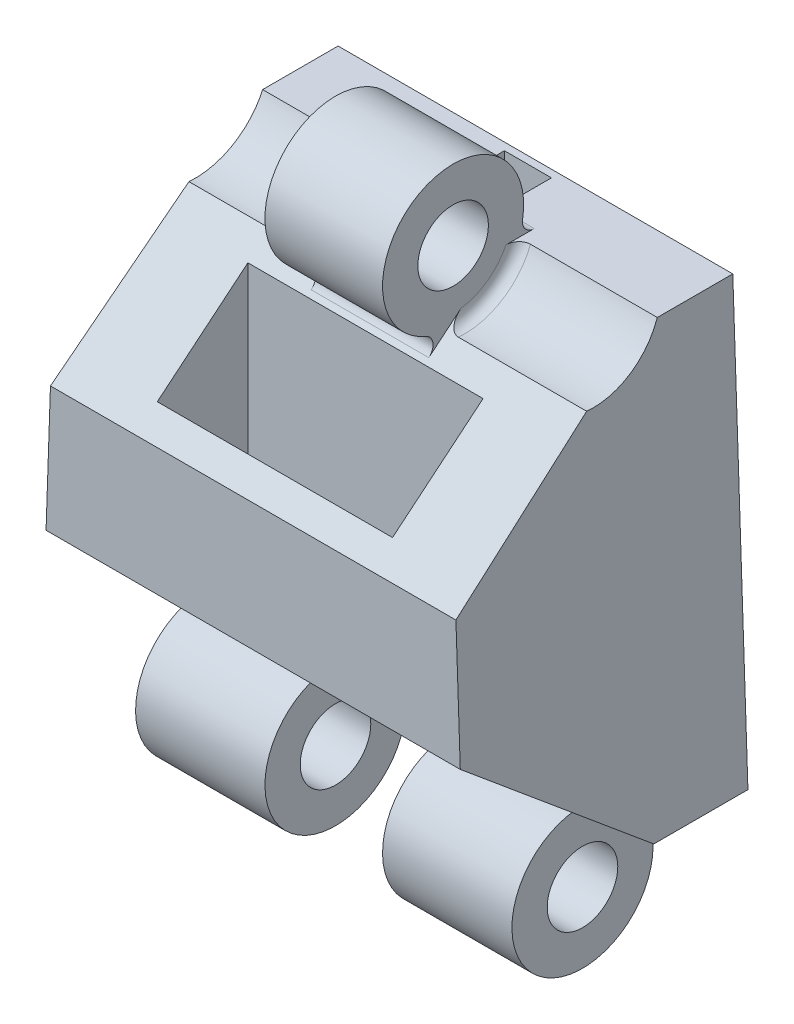
from build123d import *

# Parameters (mm, degrees)
BOSS_EXTRUDE2_DEPTH             = 12
CUT_EXTRUDE2_DEPTH              = 22.571014648492383
CUT_EXTRUDE2_DEPTH_BACK         = 22.571014648492383
SKETCH17_R                      = 3.0000000000000298
SKETCH17_R_2                    = 1.5000000000000007
BOSS_EXTRUDE3_DEPTH             = 2.5
CUT_EXTRUDE3_DEPTH              = 25.679395227729078
CUT_EXTRUDE3_DEPTH_BACK         = 25.679395227729078
SKETCH19_R                      = 1.4999999999999996
BOSS_EXTRUDE4_DEPTH             = 8
SKETCH19_3_R                    = 3.0000000000000004
CUT_EXTRUDE4_DEPTH              = 2.5
CUT_EXTRUDE5_START              = 10
SKETCH20_R                      = 2.9999999999999996
CUT_EXTRUDE5_DEPTH              = 10
SKETCH21_R                      = 2.999999999999999
CUT_EXTRUDE6_DEPTH              = 10
FILLET6_R                       = 0.5000000000000004
FILLET7_R                       = 0.5000000000000004
FILLET8_R                       = 0.5000000000000004
CUT_EXTRUDE8_DEPTH              = 25.679395276352636
CUT_EXTRUDE8_DEPTH_BACK         = 25.679395276352636
CUT_EXTRUDE9_DEPTH              = 24.90754642395463
CUT_EXTRUDE9_DEPTH_BACK         = 24.90754642395463
SKETCH26_R                      = 3
SKETCH27_R                      = 2.9999999999999996
SKETCH27_R_2                    = 1.4999999999999996
BOSS_EXTRUDE6_DEPTH             = 2.5
FILLET9_R                       = 0.5
FILLET10_R                      = 0.5
CUT_EXTRUDE10_REACH             = 22.744
SKETCH29_W                      = 10
SKETCH29_H                      = 3.8498556304138605
CUT_EXTRUDE10_DIRECTION_2_REACH = 22.744
CUT_EXTRUDE11_DEPTH             = 1


with BuildPart() as part:
    # Sketch1 → Boss-Extrude2 (new body)
    with BuildSketch(Plane.XY):
        Polygon((-7.999999999999995, -14.500000000000002), (-6.966131724806635, 15.482179980607619), (9.033868275193369, 15.482179980607619), (10.067736550386755, -14.500000000000002), align=None)
    extrude(amount=BOSS_EXTRUDE2_DEPTH)

    # Sketch16 → Cut-Extrude2 (cut, two sides: drawn at the far end of the back side and taken through both)
    with BuildSketch(Plane(origin=(1.0338682751933665, 0, 0), x_dir=(0, 0, -1), z_dir=(1, 0, 0)).offset(-CUT_EXTRUDE2_DEPTH_BACK)):
        Polygon((-12, 8.852541981440545), (-4, 15.482179980607619), (-12, 15.482179980607619), align=None)
    extrude(amount=CUT_EXTRUDE2_DEPTH + CUT_EXTRUDE2_DEPTH_BACK, mode=Mode.SUBTRACT)

    # Sketch17 → Boss-Extrude3 (add, symmetric)
    with BuildSketch(Plane(origin=(1.0338682751933665, 0, 0), x_dir=(0, 0, -1), z_dir=(1, 0, 0))):
        with Locations((-6.000000000000029, 16.582179980607627)):
            Circle(SKETCH17_R)
        with Locations((-6, 16.58217998060762)):
            Circle(SKETCH17_R_2, mode=Mode.SUBTRACT)
    extrude(amount=BOSS_EXTRUDE3_DEPTH, both=True)

    # Sketch18 → Cut-Extrude3 (cut, two sides: drawn at the far end of the back side and taken through both)
    with BuildSketch(Plane(origin=(1.0338682751933665, 0, 0), x_dir=(0, 0, -1), z_dir=(1, 0, 0)).offset(-CUT_EXTRUDE3_DEPTH_BACK)):
        Polygon((-12, -14.500000000000002), (-4, -14.500000000000002), (-12, -7.870362000832929), align=None)
    extrude(amount=CUT_EXTRUDE3_DEPTH + CUT_EXTRUDE3_DEPTH_BACK, mode=Mode.SUBTRACT)

    # Sketch19 → Boss-Extrude4 (add, symmetric)
    with BuildSketch(Plane(origin=(1.0338682751933665, 0, 0), x_dir=(0, 0, -1), z_dir=(1, 0, 0))):
        with BuildLine():
            ThreePointArc((-8.791057147390573, -14.500000000000002), (-6.5598341530436866, -18.547301430306355), (-2.9999999999999996, -15.600000000000003))
            ThreePointArc((-2.9999999999999996, -15.600000000000003), (-3.0526985696936495, -15.040165846956317), (-3.2089428526094275, -14.500000000000002))
            ThreePointArc((-3.2089428526094275, -14.500000000000002), (-6, -12.600000000000003), (-8.791057147390573, -14.500000000000002))
        make_face()
        with Locations((-6, -15.600000000000003)):
            Circle(SKETCH19_R, mode=Mode.SUBTRACT)
    extrude(amount=BOSS_EXTRUDE4_DEPTH, both=True)

    # Sketch19<3> → Cut-Extrude4 (cut, symmetric)
    with BuildSketch(Plane(origin=(1.0338682751933665, 0, 0), x_dir=(0, 0, -1), z_dir=(1, 0, 0))):
        with Locations((-6, -15.600000000000003)):
            Circle(SKETCH19_3_R)
    extrude(amount=CUT_EXTRUDE4_DEPTH, both=True, mode=Mode.SUBTRACT)

    # Sketch20 → Cut-Extrude5 (cut)
    with BuildSketch(Plane(origin=(3.5338682751933668, 0, 0), x_dir=(0, 0, -1), z_dir=(1, 0, 0)).offset(CUT_EXTRUDE5_START)):
        with Locations((-6, 16.58217998060762)):
            Circle(SKETCH20_R)
    extrude(amount=-CUT_EXTRUDE5_DEPTH, mode=Mode.SUBTRACT)

    # Sketch21 → Cut-Extrude6 (cut)
    with BuildSketch(Plane.ZY.offset(1.4661317248066335)):
        with Locations((6, 16.58217998060762)):
            Circle(SKETCH21_R)
    extrude(amount=CUT_EXTRUDE6_DEPTH, mode=Mode.SUBTRACT)

    # Fillet6
    fillet6_edges = [part.edges().sort_by_distance(p)[0] for p in [
        (1.0338682751933665, 13.59501804601977, 6.277242811538059),
    ]]
    fillet(fillet6_edges, radius=FILLET6_R)

    # Fillet7
    fillet7_edges = [part.edges().sort_by_distance(p)[0] for p in [
        (1.0338682751933665, 15.482179980607619, 3.208942852609428),
    ]]
    fillet(fillet7_edges, radius=FILLET7_R)

    # Fillet8
    fillet8_edges = [part.edges().sort_by_distance(p)[0] for p in [
        (3.5338682751933668, 14.026824950601753, 4.428325520146199),
        (-1.4661317248066335, 14.026824950601755, 4.428325520146199),
    ]]
    fillet(fillet8_edges, radius=FILLET8_R)

    # Sketch23 → Cut-Extrude8 (cut, two sides: drawn at the far end of the back side and taken through both)
    with BuildSketch(Plane(origin=(1.0338682751933665, 0, 0), x_dir=(0, 0, -1), z_dir=(1, 0, 0)).offset(-CUT_EXTRUDE8_DEPTH_BACK)):
        Polygon((0, 4.167360981024079), (0, 23.255957395128362), (-11.999999999999998, 23.255957395128362), (-11.999999999999998, -2.4622770181429927), (-4.000000000000001, 4.167360981024078), align=None)
    extrude(amount=CUT_EXTRUDE8_DEPTH + CUT_EXTRUDE8_DEPTH_BACK, mode=Mode.SUBTRACT)

    # Sketch26 → Cut-Extrude9 (cut, two sides: drawn at the far end of the back side and taken through both)
    with BuildSketch(Plane(origin=(1.0338682751933665, 0, 0), x_dir=(0, 0, -1), z_dir=(1, 0, 0)).offset(-CUT_EXTRUDE9_DEPTH_BACK)):
        with Locations((-6, 5.26736098102408)):
            Circle(SKETCH26_R)
        with BuildLine():
            ThreePointArc((-4.980196097281473, 4.167360981024053), (-7.374719217527308, 5.867483529309931), (-4.5, 5.26736098102408))
            ThreePointArc((-4.5, 5.26736098102408), (-4.625280782472692, 4.667238432738228), (-4.980196097281473, 4.167360981024053))
        make_face(mode=Mode.SUBTRACT)
    extrude(amount=CUT_EXTRUDE9_DEPTH + CUT_EXTRUDE9_DEPTH_BACK, mode=Mode.SUBTRACT)

    # Sketch27 → Boss-Extrude6 (add, symmetric)
    with BuildSketch(Plane(origin=(1.0338682751933665, 0, 0), x_dir=(0, 0, -1), z_dir=(1, 0, 0))):
        with Locations((-6, 5.26736098102408)):
            Circle(SKETCH27_R)
        with Locations((-6, 5.26736098102408)):
            Circle(SKETCH27_R_2, mode=Mode.SUBTRACT)
    extrude(amount=BOSS_EXTRUDE6_DEPTH, both=True)

    # Fillet9
    fillet9_edges = [part.edges().sort_by_distance(p)[0] for p in [
        (1.0338682751933668, 4.167360981024079, 3.2089428526094292),
        (1.0338682751933668, 2.2801990464362527, 6.277242811538037),
    ]]
    fillet(fillet9_edges, radius=FILLET9_R)

    # Fillet10
    fillet10_edges = [part.edges().sort_by_distance(p)[0] for p in [
        (-1.4661317248066335, 2.712005951018226, 4.428325520146179),
        (3.5338682751933668, 2.7120059510182273, 4.428325520146177),
    ]]
    fillet(fillet10_edges, radius=FILLET10_R)

    # Cut-Extrude10: up to this plane
    cut_extrude10_end = Plane(origin=(-7.999999999999995, -10.561614048947142, 8.752459728929596), z_dir=(0, 0.769971126082772, -0.6380787294674758))
    # Sketch29 → Cut-Extrude10 (cut, up to the surface)
    with BuildSketch(Plane(origin=(0, -5, 0), x_dir=(1, 0, 0), z_dir=(0, 1, 0)), mode=Mode.PRIVATE) as cut_extrude10_sk1:
        with Locations((1.0338682751933745, -9.151106833493746)):
            Rectangle(SKETCH29_W, SKETCH29_H)
    cut_extrude10_tool1 = split(extrude(cut_extrude10_sk1.sketch, amount=-CUT_EXTRUDE10_REACH, mode=Mode.PRIVATE), bisect_by=cut_extrude10_end, keep=Keep.BOTH, mode=Mode.PRIVATE)
    add(cut_extrude10_tool1.solids().sort_by_distance((1.033868, -5, 9.151107))[0], mode=Mode.SUBTRACT)

    # Cut-Extrude10 direction 2: up to this plane
    cut_extrude10_direction_2_end = Plane(origin=(-7.999999999999995, -2.4622770181429927, 11.999999999999998), z_dir=(0, -0.769971126082772, -0.6380787294674759))
    # Sketch29 → Cut-Extrude10 direction 2 (cut, up to the surface)
    with BuildSketch(Plane(origin=(0, -5, 0), x_dir=(1, 0, 0), z_dir=(0, 1, 0)), mode=Mode.PRIVATE) as cut_extrude10_direction_2_sk1:
        with Locations((1.0338682751933745, -9.151106833493746)):
            Rectangle(SKETCH29_W, SKETCH29_H)
    cut_extrude10_direction_2_tool1 = split(extrude(cut_extrude10_direction_2_sk1.sketch, amount=CUT_EXTRUDE10_DIRECTION_2_REACH, mode=Mode.PRIVATE), bisect_by=cut_extrude10_direction_2_end, keep=Keep.BOTH, mode=Mode.PRIVATE)
    add(cut_extrude10_direction_2_tool1.solids().sort_by_distance((1.033868, -5, 9.151107))[0], mode=Mode.SUBTRACT)

    # Sketch30 → Cut-Extrude11 (cut, symmetric)
    with BuildSketch(Plane(origin=(1.0338682751933665, 0, 0), x_dir=(0, 0, -1), z_dir=(1, 0, 0))):
        Polygon((-0.3199999999999974, -17.57883049775079), (-0.3199999999999974, 4.167360981024078), (-2.3200000000000003, 4.16736098102408), (-2.32, -17.578830497750786), align=None)
    extrude(amount=CUT_EXTRUDE11_DEPTH, both=True, mode=Mode.SUBTRACT)


solid = part.part
